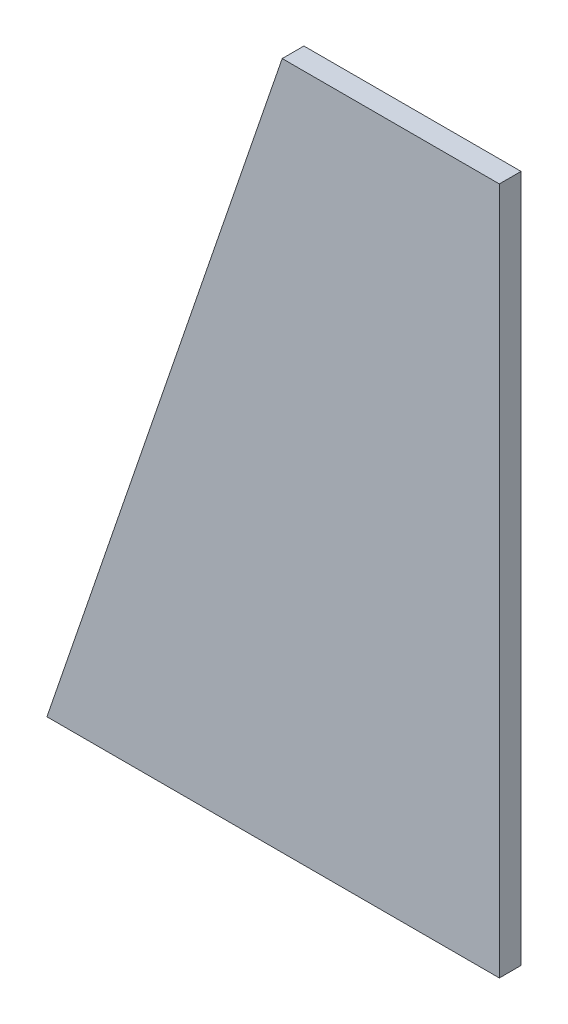
from build123d import *

# Parameters (mm, degrees)
BOSS_EXTRUDE1_DEPTH = 3


with BuildPart() as part:
    # Sketch1 → Boss-Extrude1 (new, symmetric)
    with BuildSketch(Plane.XY):
        Polygon((125, 190), (65, 190), (14.368421053, 42), (125, 42), align=None)
        Polygon((125, 42), (14.368421053, 42), (0, 0), (125, 0), align=None)
    extrude(amount=BOSS_EXTRUDE1_DEPTH, both=True)


solid = part.part
